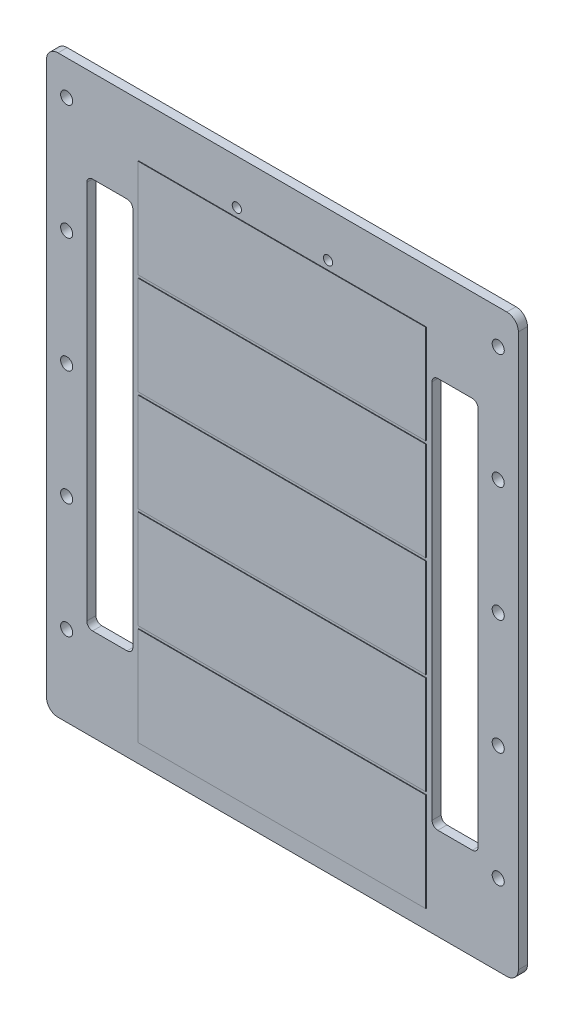
from build123d import *

# Parameters (mm, degrees)
SKETCH1_W          = 82
SKETCH1_H          = 100
BOARD_DEPTH        = 1.5875
SKETCH2_W          = 8
SKETCH2_H          = 68
ACCESS_HOLES_DEPTH = 65.680137262
SCREW_HOLES_D      = 2.1
CONNECTOR_HOLES_D  = 1.6
SKETCH4_W          = 50
SKETCH4_H          = 17.1
SOLAR_CELLS_DEPTH  = 0.1
OUTER_RADIUS_R     = 2
ACCESS_FILLET_R    = 1


with BuildPart() as part:
    # Sketch1 → board (new body)
    with BuildSketch(Plane.XY.offset(1.5875)):
        Rectangle(SKETCH1_W, SKETCH1_H)
    extrude(amount=-BOARD_DEPTH)

    # Sketch2 → access holes (cut, through all)
    with BuildSketch(Plane.XY.offset(1.5875)):
        with Locations((-30, 0)):
            Rectangle(SKETCH2_W, SKETCH2_H)
        with Locations((30, 0)):
            Rectangle(SKETCH2_W, SKETCH2_H)
    extrude(amount=-ACCESS_HOLES_DEPTH, mode=Mode.SUBTRACT)

    # screw holes (through all)
    with Locations(Plane(origin=(0, 0, 0), x_dir=(-1, 0, 0), z_dir=(0, 0, -1))):
        with Locations((37.5, 44), (37.5, 24), (37.5, 4), (37.5, -16), (37.5, -36), (-37.5, -36), (-37.5, -16), (-37.5, 4), (-37.5, 24), (-37.5, 44)):
            Hole(SCREW_HOLES_D / 2)

    # connector holes (through all)
    with Locations(Plane(origin=(0, 0, 0), x_dir=(-1, 0, 0), z_dir=(0, 0, -1))):
        with Locations((7.925, 42.25), (-7.925, 42.25)):
            Hole(CONNECTOR_HOLES_D / 2)

    # Sketch4 → solar cells (add)
    with BuildSketch(Plane.XY.offset(1.5875)):
        with Locations((0, 32.2)):
            Rectangle(SKETCH4_W, SKETCH4_H)
        with Locations((0, 14.6)):
            Rectangle(SKETCH4_W, SKETCH4_H)
        with Locations((0, -3)):
            Rectangle(SKETCH4_W, SKETCH4_H)
        with Locations((0, -20.6)):
            Rectangle(SKETCH4_W, SKETCH4_H)
        with Locations((0, -38.2)):
            Rectangle(SKETCH4_W, SKETCH4_H)
    extrude(amount=SOLAR_CELLS_DEPTH)

    # outer radius
    outer_radius_edges = [part.edges().sort_by_distance(p)[0] for p in [
        (-41, -50, 0.79375),
        (-41, 50, 0.79375),
        (41, 50, 0.79375),
        (41, -50, 0.79375),
    ]]
    fillet(outer_radius_edges, radius=OUTER_RADIUS_R)

    # access fillet
    access_fillet_edges = [part.edges().sort_by_distance(p)[0] for p in [
        (-26, 34, 0.79375),
        (-26, -34, 0.79375),
        (-34, -34, 0.79375),
        (-34, 34, 0.79375),
        (34, 34, 0.79375),
        (34, -34, 0.79375),
        (26, -34, 0.79375),
        (26, 34, 0.79375),
    ]]
    fillet(access_fillet_edges, radius=ACCESS_FILLET_R)


solid = part.part
